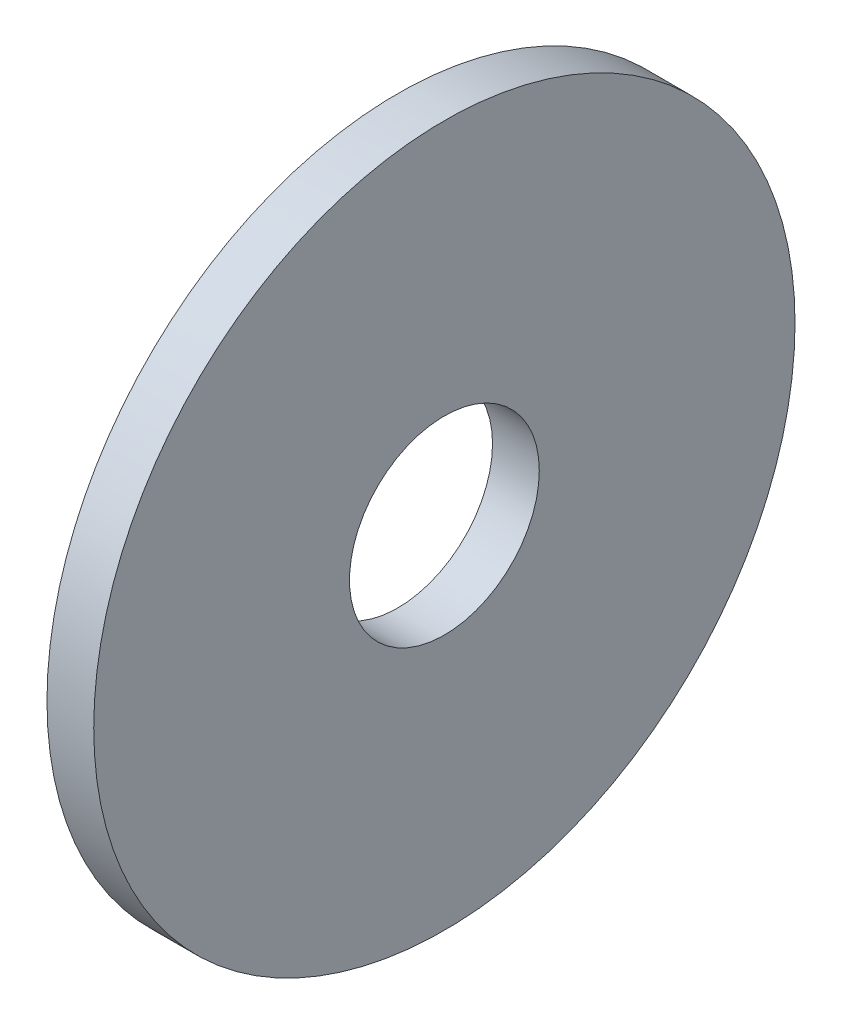
from build123d import *

# Parameters (mm, degrees)
SKETCH1_R           = 9.525
SKETCH1_R_2         = 2.5781
BOSS_EXTRUDE1_DEPTH = 1.27


with BuildPart() as part:
    # Sketch1 → Boss-Extrude1 (new body)
    with BuildSketch(Plane(origin=(0, 0, 0), x_dir=(0, 0, -1), z_dir=(1, 0, 0))):
        Circle(SKETCH1_R)
        Circle(SKETCH1_R_2, mode=Mode.SUBTRACT)
    extrude(amount=BOSS_EXTRUDE1_DEPTH)


solid = part.part
